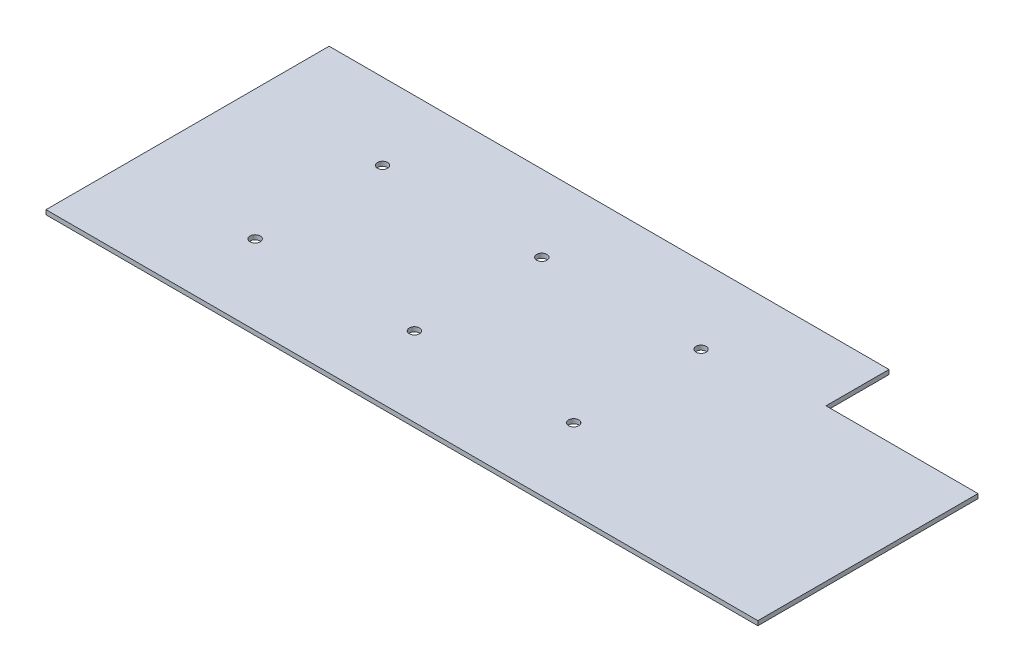
from build123d import *

# Parameters (mm, degrees)
BOSS_EXTRUDE1_DEPTH     = 3.5
CUT_EXTRUDE1_DEPTH      = 602.385693628
CUT_EXTRUDE1_DEPTH_BACK = 602.385693628
SKETCH2_R               = 4


with BuildPart() as part:
    # Sketch1 → Boss-Extrude1 (new body)
    with BuildSketch(Plane(origin=(0, 0, 0), x_dir=(1, 0, 0), z_dir=(0, 1, 0))):
        Polygon((0, 0), (0, 222.25), (439.5, 222.25), (439.5, 172.8), (558.8, 172.8), (558.8, 0), align=None)
    extrude(amount=BOSS_EXTRUDE1_DEPTH)

    # Sketch2 → Cut-Extrude1 (cut, two sides: drawn at the far end of the back side and taken through both)
    with BuildSketch(Plane(origin=(0, 3.5, 0), x_dir=(1, 0, 0), z_dir=(0, 1, 0)).offset(-CUT_EXTRUDE1_DEPTH_BACK)):
        with Locations((101.97168799, 162.2158083)):
            Circle(SKETCH2_R)
        with Locations((226.97168799, 162.2158083)):
            Circle(SKETCH2_R)
        with Locations((351.97168799, 162.2158083)):
            Circle(SKETCH2_R)
        with Locations((351.97168799, 62.2158083)):
            Circle(SKETCH2_R)
        with Locations((226.97168799, 62.2158083)):
            Circle(SKETCH2_R)
        with Locations((101.97168799, 62.2158083)):
            Circle(SKETCH2_R)
    extrude(amount=CUT_EXTRUDE1_DEPTH + CUT_EXTRUDE1_DEPTH_BACK, mode=Mode.SUBTRACT)


solid = part.part
